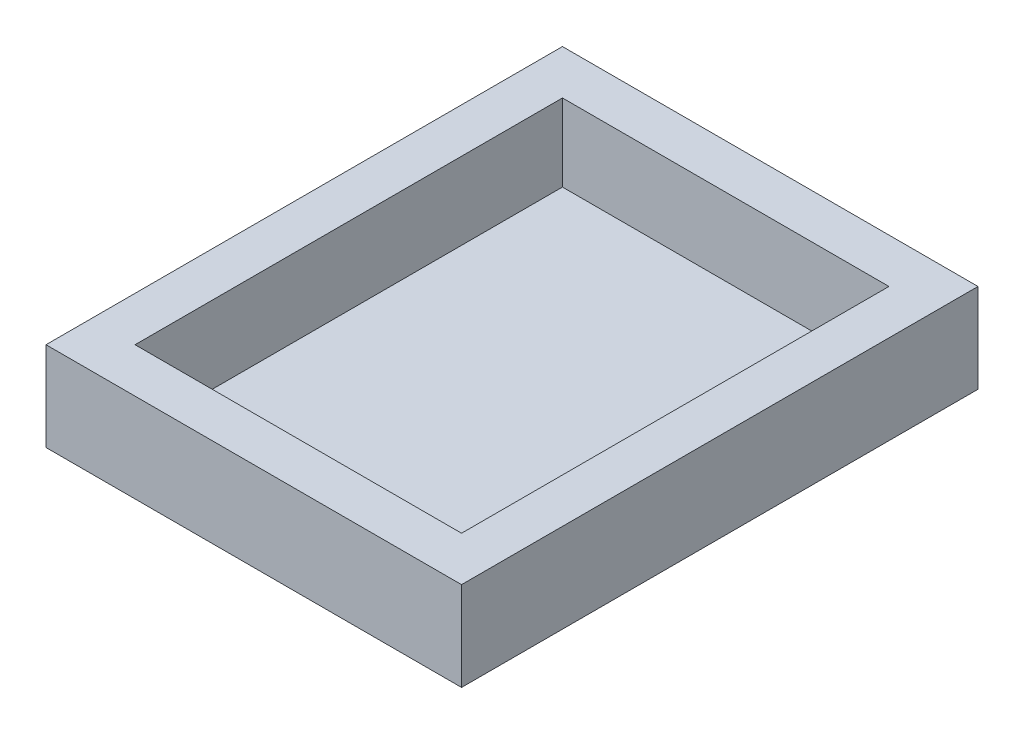
from build123d import *

# Parameters (mm, degrees)
SKETCH1_W           = 70
SKETCH1_H           = 87
BOSS_EXTRUDE1_DEPTH = 15
SKETCH2_W           = 55
SKETCH2_H           = 72
CUT_EXTRUDE1_DEPTH  = 13


with BuildPart() as part:
    # Sketch1 → Boss-Extrude1 (new body)
    with BuildSketch(Plane(origin=(0, 0, 0), x_dir=(1, 0, 0), z_dir=(0, 1, 0))):
        Rectangle(SKETCH1_W, SKETCH1_H)
    extrude(amount=BOSS_EXTRUDE1_DEPTH)

    # Sketch2 → Cut-Extrude1 (cut)
    with BuildSketch(Plane(origin=(0, 15, 0), x_dir=(1, 0, 0), z_dir=(0, 1, 0))):
        Rectangle(SKETCH2_W, SKETCH2_H)
    extrude(amount=-CUT_EXTRUDE1_DEPTH, mode=Mode.SUBTRACT)


solid = part.part
